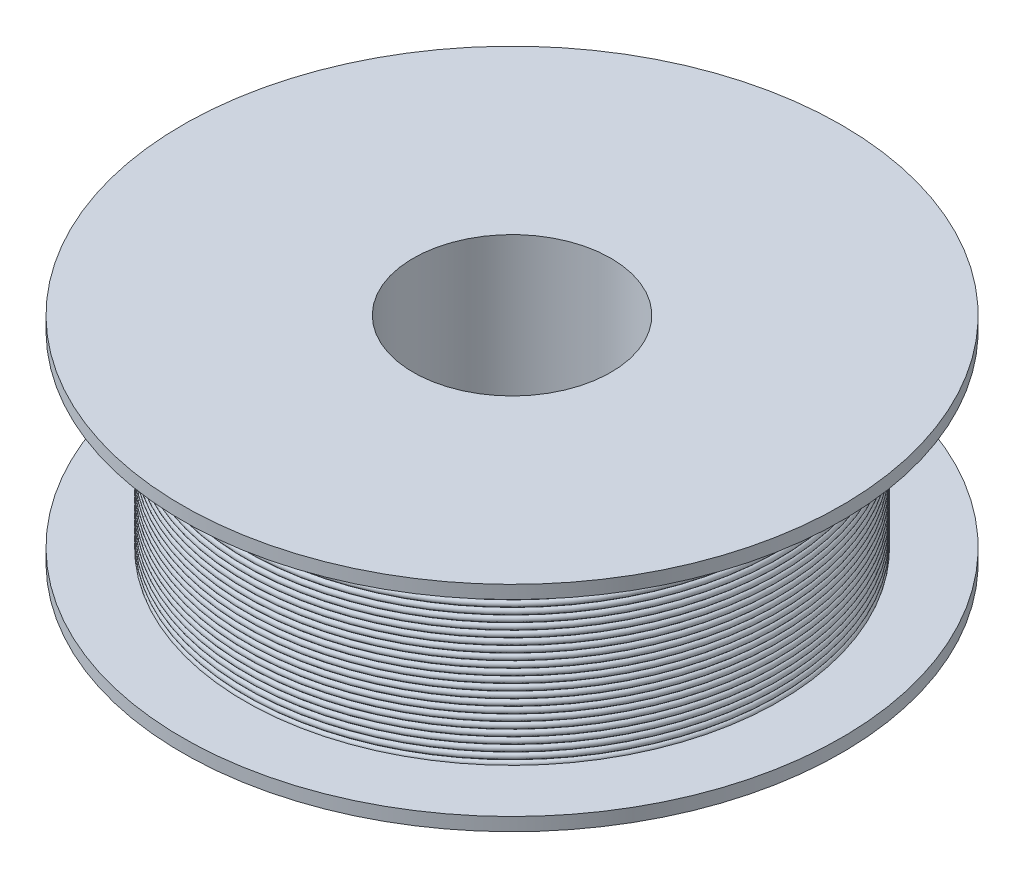
from build123d import *


with BuildPart() as part:
    # Sketch1 → Revolve1 (revolve)
    with BuildSketch(Plane.XY, mode=Mode.PRIVATE) as revolve1_sk:
        Polygon((30, 65), (100, 65), (100, 61), (40, 61), (40, 4), (100, 4), (100, 0), (30, 0), align=None)
    revolve(revolve1_sk.sketch.rotate(Axis((0, 0, 0), (0, 1, 0)), 90), axis=Axis((0, 0, 0), (0, 1, 0)))


with BuildPart() as body_2:
    # Sketch2 → Revolve2 (revolve)
    with BuildSketch(Plane.XY, mode=Mode.PRIVATE) as revolve2_sk:
        with BuildLine():
            Line((-80, 51), (-80, 53))
            ThreePointArc((-80, 53), (-81, 52), (-80, 51))
        make_face()
        with BuildLine():
            Line((-80, 53), (-80, 55))
            ThreePointArc((-80, 55), (-81, 54), (-80, 53))
        make_face()
        with BuildLine():
            Line((-80, 55), (-80, 57))
            ThreePointArc((-80, 57), (-81, 56), (-80, 55))
        make_face()
        with BuildLine():
            Line((-80, 57), (-80, 59))
            ThreePointArc((-80, 59), (-81, 58), (-80, 57))
        make_face()
        with BuildLine():
            Line((-80, 59), (-80, 61))
            ThreePointArc((-80, 61), (-81, 60), (-80, 59))
        make_face()
        with BuildLine():
            Line((-80, 47), (-80, 49))
            ThreePointArc((-80, 49), (-81, 48), (-80, 47))
        make_face()
        with BuildLine():
            Line((-80, 49), (-80, 51))
            ThreePointArc((-80, 51), (-81, 50), (-80, 49))
        make_face()
        with BuildLine():
            Line((-80, 45), (-80, 47))
            ThreePointArc((-80, 47), (-81, 46), (-80, 45))
        make_face()
        with BuildLine():
            Line((-80, 43), (-80, 45))
            ThreePointArc((-80, 45), (-81, 44), (-80, 43))
        make_face()
        with BuildLine():
            Line((-80, 41), (-80, 43))
            ThreePointArc((-80, 43), (-81, 42), (-80, 41))
        make_face()
        with BuildLine():
            Line((-80, 39), (-80, 41))
            ThreePointArc((-80, 41), (-81, 40), (-80, 39))
        make_face()
        with BuildLine():
            Line((-80, 37), (-80, 39))
            ThreePointArc((-80, 39), (-81, 38), (-80, 37))
        make_face()
        with BuildLine():
            Line((-80, 35), (-80, 37))
            ThreePointArc((-80, 37), (-81, 36), (-80, 35))
        make_face()
        with BuildLine():
            Line((-80, 33), (-80, 35))
            ThreePointArc((-80, 35), (-81, 34), (-80, 33))
        make_face()
        with BuildLine():
            Line((-80, 31), (-80, 33))
            ThreePointArc((-80, 33), (-81, 32), (-80, 31))
        make_face()
        with BuildLine():
            Line((-80, 27), (-80, 29))
            ThreePointArc((-80, 29), (-81, 28), (-80, 27))
        make_face()
        with BuildLine():
            Line((-80, 29), (-80, 31))
            ThreePointArc((-80, 31), (-81, 30), (-80, 29))
        make_face()
        with BuildLine():
            Line((-80, 25), (-80, 27))
            ThreePointArc((-80, 27), (-81, 26), (-80, 25))
        make_face()
        with BuildLine():
            Line((-80, 23), (-80, 25))
            ThreePointArc((-80, 25), (-81, 24), (-80, 23))
        make_face()
        with BuildLine():
            Line((-80, 21), (-80, 23))
            ThreePointArc((-80, 23), (-81, 22), (-80, 21))
        make_face()
        with BuildLine():
            Line((-80, 19), (-80, 21))
            ThreePointArc((-80, 21), (-81, 20), (-80, 19))
        make_face()
        with BuildLine():
            Line((-80, 17), (-80, 19))
            ThreePointArc((-80, 19), (-81, 18), (-80, 17))
        make_face()
        with BuildLine():
            Line((-80, 15), (-80, 17))
            ThreePointArc((-80, 17), (-81, 16), (-80, 15))
        make_face()
        with BuildLine():
            Line((-80, 13), (-80, 15))
            ThreePointArc((-80, 15), (-81, 14), (-80, 13))
        make_face()
        with BuildLine():
            Line((-80, 11), (-80, 13))
            ThreePointArc((-80, 13), (-81, 12), (-80, 11))
        make_face()
        with BuildLine():
            Line((-80, 9), (-80, 11))
            ThreePointArc((-80, 11), (-81, 10), (-80, 9))
        make_face()
        with BuildLine():
            Line((-80, 7), (-80, 9))
            ThreePointArc((-80, 9), (-81, 8), (-80, 7))
        make_face()
        with BuildLine():
            Line((-80, 5), (-80, 7))
            ThreePointArc((-80, 7), (-81, 6), (-80, 5))
        make_face()
        with BuildLine():
            Line((-80, 4), (-80, 5))
            ThreePointArc((-80, 5), (-80.707106781, 4.707106781), (-81, 4))
            Line((-81, 4), (-80, 4))
        make_face()
    revolve(revolve2_sk.sketch.rotate(Axis((0, 0, 0), (0, 1, 0)), 270), axis=Axis((0, 0, 0), (0, 1, 0)))


solid = Compound([part.part, body_2.part])
